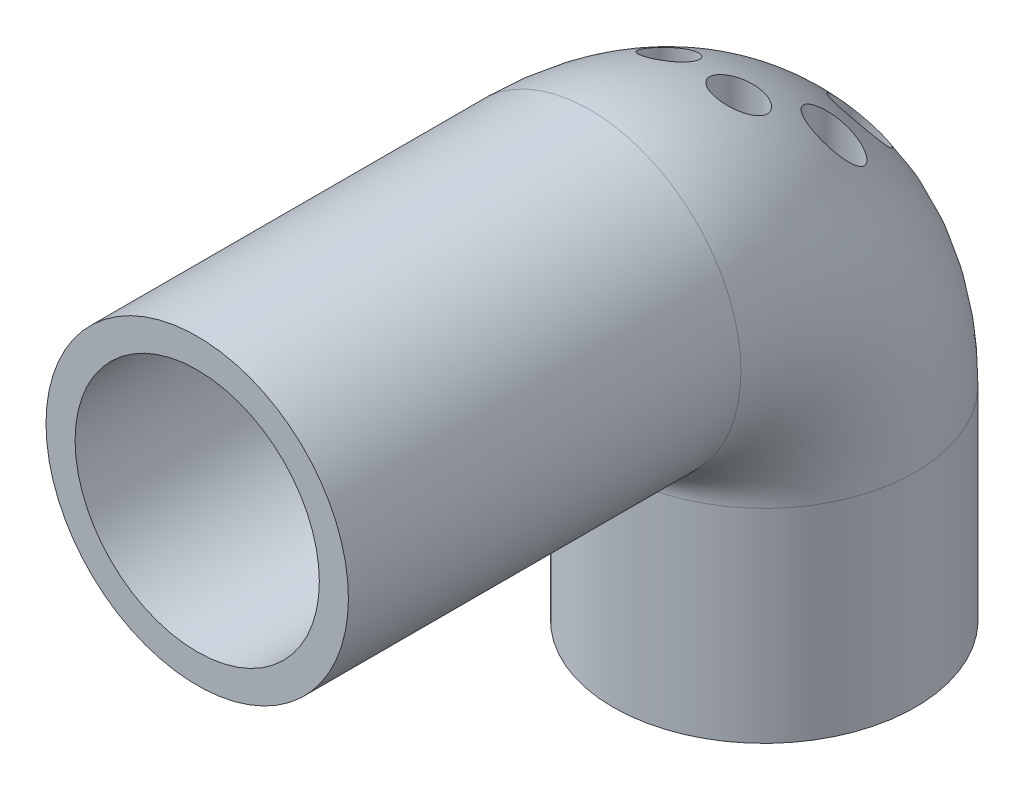
from build123d import *

# Parameters (mm, degrees)
SKETCH1_R                                       = 26
BOSS_EXTRUDE1_DEPTH                             = 5
CSK_FOR_M4_FLAT_HEAD_MACHINE_SCREW2_D           = 4.5
CSK_FOR_M4_FLAT_HEAD_MACHINE_SCREW2_CSINK_D     = 8
CSK_FOR_M4_FLAT_HEAD_MACHINE_SCREW2_CSINK_ANGLE = 90
SKETCH11_R                                      = 26
SKETCH11_R_2                                    = 21
SKETCH13_R                                      = 4
CUT_EXTRUDE1_DEPTH                              = 100
SKETCH14_R                                      = 2.9
CUT_EXTRUDE2_DEPTH                              = 1
BOSS_EXTRUDE2_START                             = 37.5
SKETCH15_R                                      = 26
SKETCH15_R_2                                    = 21
BOSS_EXTRUDE2_DEPTH                             = 37.5


with BuildPart() as part:
    # Sketch1 → Boss-Extrude1 (new body)
    with BuildSketch(Plane(origin=(0, 0, 0), x_dir=(1, 0, 0), z_dir=(0, 1, 0))):
        with Locations(Location((0, 0, 0), (0, 0, 270))):
            Circle(SKETCH1_R)
    extrude(amount=BOSS_EXTRUDE1_DEPTH)

    # CSK for M4 Flat Head Machine Screw2 (through all)
    with Locations(Plane(origin=(0, 5, 0), x_dir=(1, 0, 0), z_dir=(0, 1, 0))):
        with Locations((-6, 10.392304845), (-12, 0), (12, 0), (6, 10.392304845), (-6, -10.392304845), (6, -10.392304845)):
            CounterSinkHole(CSK_FOR_M4_FLAT_HEAD_MACHINE_SCREW2_D / 2, CSK_FOR_M4_FLAT_HEAD_MACHINE_SCREW2_CSINK_D / 2, counter_sink_angle=CSK_FOR_M4_FLAT_HEAD_MACHINE_SCREW2_CSINK_ANGLE)

    # Sweep3: sweep along a path in Sketch10
    with BuildLine(Plane(origin=(0, 0, 0), x_dir=(0, 0, -1), z_dir=(1, 0, 0))) as sweep3_path:
        Line((0, 5), (0, 35))
        ThreePointArc((0, 35), (-8.786796564, 56.213203436), (-30, 65))
        Line((-30, 65), (-60, 65))
    # Sketch11 → Sweep3 (sweep)
    with BuildSketch(Plane(origin=(0, 5, 0), x_dir=(1, 0, 0), z_dir=(0, 1, 0))):
        Circle(SKETCH11_R)
        Circle(SKETCH11_R_2, mode=Mode.SUBTRACT)
    sweep(path=sweep3_path.line)

    # Sketch13 → Cut-Extrude1 (cut)
    with BuildSketch(Plane(origin=(0, 39, 0), x_dir=(-1, 0, 0), z_dir=(0, -1, 0))):
        with Locations(Location((6, 10.392304845, 0), (0, 0, 69.705875047))):
            Circle(SKETCH13_R)
        with Locations(Location((-6, 10.392304845, 0), (0, 0, 74.301849625))):
            Circle(SKETCH13_R)
        with Locations(Location((-12, 0, 0), (0, 0, 58.652479001))):
            Circle(SKETCH13_R)
        with Locations(Location((-6, -10.392304845, 0), (0, 0, 55.656646254))):
            Circle(SKETCH13_R)
        with Locations(Location((6, -10.392304845, 0), (0, 0, 46.026357991))):
            Circle(SKETCH13_R)
        with Locations(Location((12, 0, 0), (0, 0, 43.940076892))):
            Circle(SKETCH13_R)
    extrude(amount=-CUT_EXTRUDE1_DEPTH, mode=Mode.SUBTRACT)

    # Sketch14 → Cut-Extrude2 (cut)
    with BuildSketch(Plane.XZ):
        with Locations(Location((0, 8.85, 0), (0, 0, 270))):
            Circle(SKETCH14_R)
        with Locations(Location((7.664324823, -4.425, 0), (0, 0, 270))):
            Circle(SKETCH14_R)
        with Locations(Location((-7.664324823, -4.425, 0), (0, 0, 270))):
            Circle(SKETCH14_R)
    extrude(amount=-CUT_EXTRUDE2_DEPTH, mode=Mode.SUBTRACT)

    # Sketch15 → Boss-Extrude2 (add)
    with BuildSketch(Plane.XY.offset(60).offset(BOSS_EXTRUDE2_START)):
        with Locations((0, 65)):
            Circle(SKETCH15_R)
        with Locations((0, 65)):
            Circle(SKETCH15_R_2, mode=Mode.SUBTRACT)
    extrude(amount=-BOSS_EXTRUDE2_DEPTH)


solid = part.part
